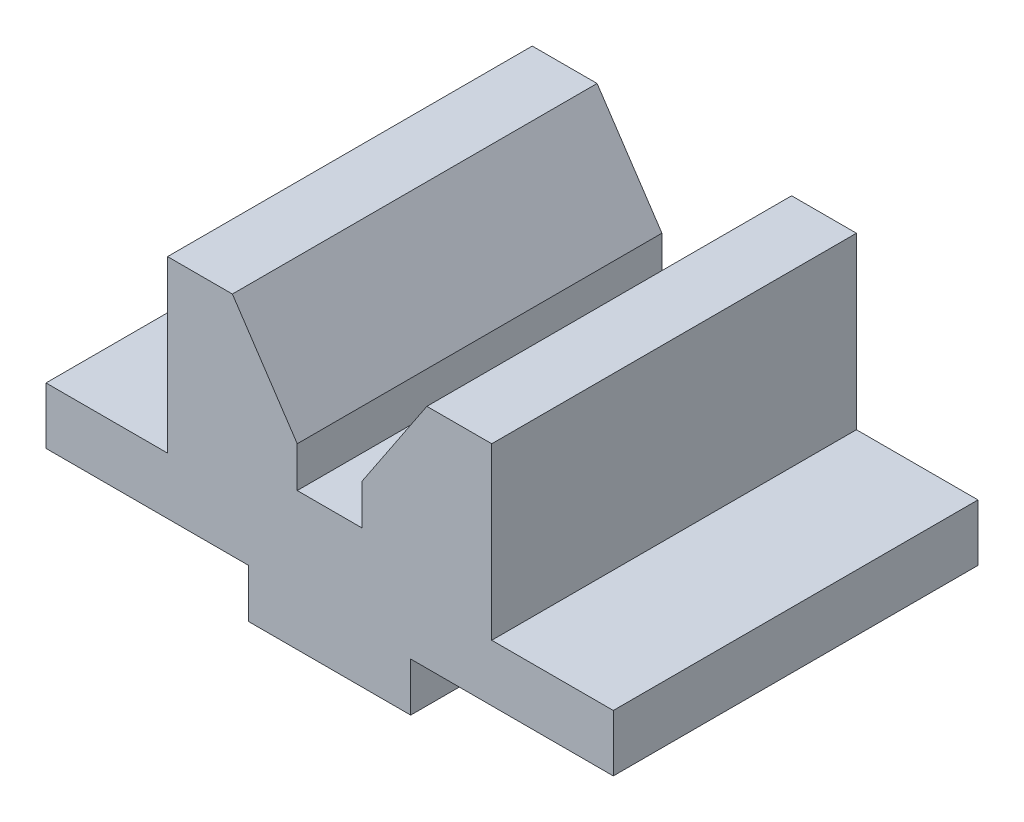
from build123d import *

# Parameters (mm, degrees)
BOSS_EXTRUDE1_DEPTH = 45


with BuildPart() as part:
    # Sketch1 → Boss-Extrude1 (new body)
    with BuildSketch(Plane.XY):
        Polygon((-10, 0), (10, 0), (10, 6), (35, 6), (35, 13), (20, 13), (20, 34), (12, 34), (4, 22), (4, 17), (-4, 17), (-4, 22), (-12, 34), (-20, 34), (-20, 13), (-35, 13), (-35, 6), (-10, 6), align=None)
    extrude(amount=BOSS_EXTRUDE1_DEPTH)


solid = part.part
